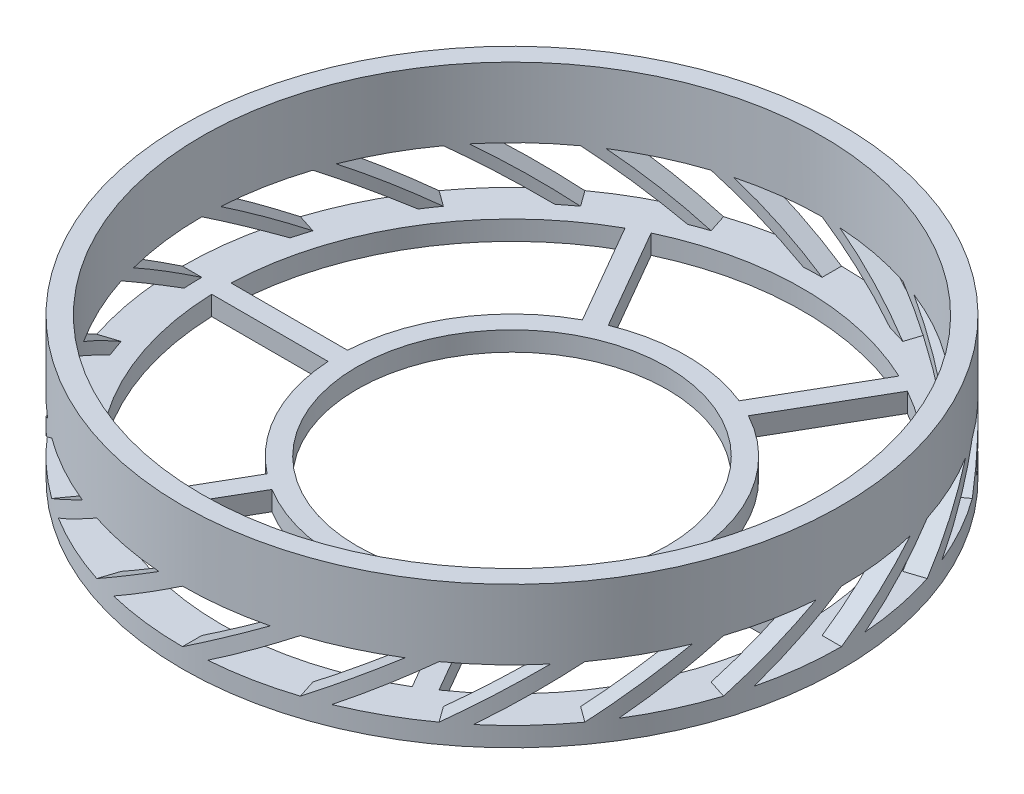
from build123d import *

# Parameters (mm, degrees)
SKETCH2_R               = 26.9875
BOSS_EXTRUDE1_DEPTH     = 11.5951
SHELL1_T                = -1.5875
CUT_EXTRUDE1_DEPTH      = 40.456334983
CUT_EXTRUDE1_DEPTH_BACK = 40.456334983
SKETCH5_R               = 12.7
CUT_EXTRUDE2_DEPTH      = 38.1
CIRPATTERN3_COUNT       = 20
CUT_EXTRUDE3_DEPTH      = 40.456334983
CUT_EXTRUDE3_DEPTH_BACK = 40.456334983


with BuildPart() as part:
    # Sketch2 → Boss-Extrude1 (new body)
    with BuildSketch(Plane(origin=(0, 0, 0), x_dir=(1, 0, 0), z_dir=(0, 1, 0))):
        Circle(SKETCH2_R)
    extrude(amount=BOSS_EXTRUDE1_DEPTH)

    # Shell1
    shell1_openings = [part.faces().sort_by_distance(p)[0] for p in [
        (0, 11.5951, 0),
    ]]
    offset(amount=SHELL1_T, openings=shell1_openings, kind=Kind.INTERSECTION)

    # Sketch5 → Cut-Extrude1 (cut, two sides: drawn at the far end of the back side and taken through both)
    with BuildSketch(Plane(origin=(0, 1.5875, 0), x_dir=(1, 0, 0), z_dir=(0, 1, 0)).offset(-CUT_EXTRUDE1_DEPTH_BACK)):
        Circle(SKETCH5_R)
    extrude(amount=CUT_EXTRUDE1_DEPTH + CUT_EXTRUDE1_DEPTH_BACK, mode=Mode.SUBTRACT)

    # Sketch6 → Cut-Extrude2 (cut)
    with BuildSketch(Plane.XY):
        Polygon((6.413577678, 1.5875), (0, 5.8801), (-6.413577678, 5.8801), (0, 1.5875), align=None)
    cut_extrude2 = extrude(amount=-CUT_EXTRUDE2_DEPTH, mode=Mode.SUBTRACT)

    # CirPattern3: Cut-Extrude2 ×20 about axis
    cirpattern3_axis = Axis((0, 11.5951, 0), (0, -1, 0))
    for i in range(1, CIRPATTERN3_COUNT):
        add(cut_extrude2.rotate(cirpattern3_axis, i * 360 / CIRPATTERN3_COUNT), mode=Mode.SUBTRACT)

    # Sketch7 → Cut-Extrude3 (cut, two sides: drawn at the far end of the back side and taken through both)
    with BuildSketch(Plane(origin=(0, 1.5875, 0), x_dir=(1, 0, 0), z_dir=(0, 1, 0)).offset(-CUT_EXTRUDE3_DEPTH_BACK)):
        with BuildLine():
            ThreePointArc((-23.799267157, -0.79375), (-20.913926743, -11.386080292), (-13.583355992, -19.558312715))
            Line((-13.583355992, -19.558312715), (-8.793031725, -11.261227701))
            ThreePointArc((-8.793031725, -11.261227701), (-12.661565337, -6.619472748), (-14.26543435, -0.79375))
            Line((-14.26543435, -0.79375), (-23.799267157, -0.79375))
        make_face()
        with BuildLine():
            Line((-7.484697224, -12.170125871), (-12.248300071, -20.42092803))
            ThreePointArc((-12.248300071, -20.42092803), (0, -23.8125), (12.248300071, -20.42092803))
            Line((12.248300071, -20.42092803), (7.484697224, -12.170125871))
            ThreePointArc((7.484697224, -12.170125871), (0, -14.2875), (-7.484697224, -12.170125871))
        make_face()
        with BuildLine():
            ThreePointArc((-11.560892407, 20.81780303), (-20.318117433, 12.418102118), (-23.799267157, 0.79375))
            Line((-23.799267157, 0.79375), (-14.26543435, 0.79375))
            ThreePointArc((-14.26543435, 0.79375), (-12.064905455, 7.653150502), (-6.79728956, 12.567000871))
            Line((-6.79728956, 12.567000871), (-11.560892407, 20.81780303))
        make_face()
        with BuildLine():
            Line((8.793031725, -11.261227701), (13.583355992, -19.558312715))
            ThreePointArc((13.583355992, -19.558312715), (20.913926743, -11.386080292), (23.799267157, -0.79375))
            Line((23.799267157, -0.79375), (14.26543435, -0.79375))
            ThreePointArc((14.26543435, -0.79375), (12.661565337, -6.619472748), (8.793031725, -11.261227701))
        make_face()
        with BuildLine():
            ThreePointArc((10.14631767, 21.542687715), (0, 23.8125), (-10.14631767, 21.542687715))
            Line((-10.14631767, 21.542687715), (-5.355993404, 13.245602701))
            ThreePointArc((-5.355993404, 13.245602701), (0, 14.2875), (5.355993404, 13.245602701))
            Line((5.355993404, 13.245602701), (10.14631767, 21.542687715))
        make_face()
        with BuildLine():
            ThreePointArc((6.79728956, 12.567000871), (12.064905455, 7.653150502), (14.26543435, 0.79375))
            Line((14.26543435, 0.79375), (23.799267157, 0.79375))
            ThreePointArc((23.799267157, 0.79375), (20.318117433, 12.418102118), (11.560892407, 20.81780303))
            Line((11.560892407, 20.81780303), (6.79728956, 12.567000871))
        make_face()
    extrude(amount=CUT_EXTRUDE3_DEPTH + CUT_EXTRUDE3_DEPTH_BACK, mode=Mode.SUBTRACT)


solid = part.part
